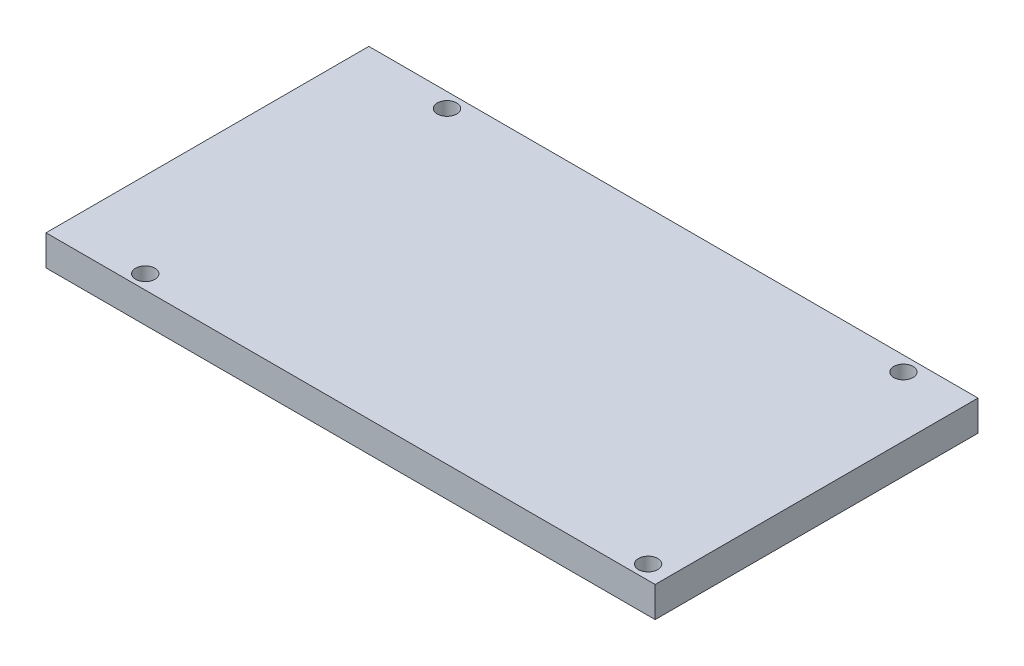
from build123d import *

# Parameters (mm, degrees)
SKETCH1_W           = 100
SKETCH1_H           = 53
BOSS_EXTRUDE1_DEPTH = 5
SKETCH2_R           = 1.5875
CUT_EXTRUDE1_DEPTH  = 57.808890149


with BuildPart() as part:
    # Sketch1 → Boss-Extrude1 (new body)
    with BuildSketch(Plane(origin=(0, 0, 0), x_dir=(1, 0, 0), z_dir=(0, 1, 0))):
        Rectangle(SKETCH1_W, SKETCH1_H)
    extrude(amount=BOSS_EXTRUDE1_DEPTH)

    # Sketch2 → Cut-Extrude1 (cut, through all)
    with BuildSketch(Plane.XZ):
        with Locations(Location((46.52, 24.173, 0), (0, 0, 270))):
            Circle(SKETCH2_R)
        with Locations(Location((40.17, -24.087, 0), (0, 0, 270))):
            Circle(SKETCH2_R)
        with Locations(Location((-34.76, -24.087, 0), (0, 0, 270))):
            Circle(SKETCH2_R)
        with Locations(Location((-36.03, 24.173, 0), (0, 0, 270))):
            Circle(SKETCH2_R)
    extrude(amount=-CUT_EXTRUDE1_DEPTH, mode=Mode.SUBTRACT)


solid = part.part
